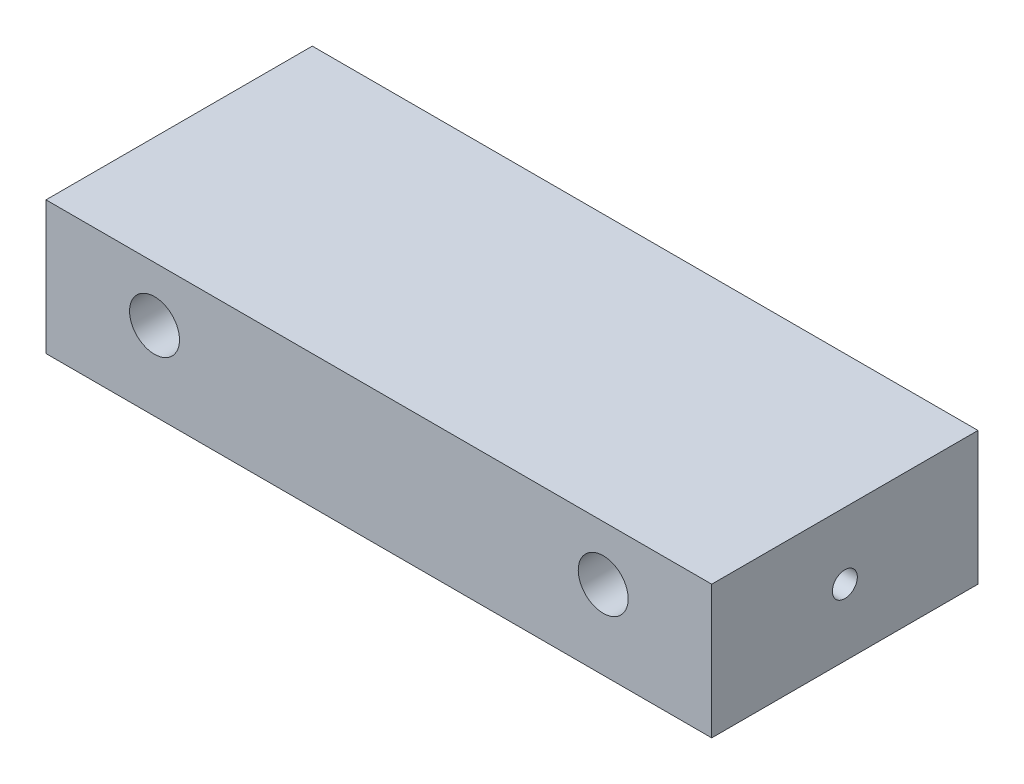
from build123d import *

# Parameters (mm, degrees)
SKETCH1_W           = 254
SKETCH1_H           = 50.8
BOSS_EXTRUDE1_DEPTH = 101.6
SKETCH2_R           = 9.525
CUT_EXTRUDE1_DEPTH  = 25.4
SKETCH3_R           = 4.7625
CUT_EXTRUDE2_DEPTH  = 25.4
SKETCH4_R           = 4.7625
CUT_EXTRUDE3_DEPTH  = 25.4
CUT_EXTRUDE4_START  = -25.4
SKETCH5_R           = 4.7625
CUT_EXTRUDE4_DEPTH  = 25.4


with BuildPart() as part:
    # Sketch1 → Boss-Extrude1 (new body)
    with BuildSketch(Plane.XY):
        Rectangle(SKETCH1_W, SKETCH1_H)
    extrude(amount=BOSS_EXTRUDE1_DEPTH)

    # Sketch2 → Cut-Extrude1 (cut)
    with BuildSketch(Plane.XY.offset(101.6)):
        with Locations((-85.598, 4.5974)):
            Circle(SKETCH2_R)
        with Locations(Location((85.598, 4.5974, 0), (0, 0, 180))):
            Circle(SKETCH2_R)
    extrude(amount=-CUT_EXTRUDE1_DEPTH, mode=Mode.SUBTRACT)

    # Sketch3 → Cut-Extrude2 (cut)
    with BuildSketch(Plane(origin=(0, 0, 0), x_dir=(-1, 0, 0), z_dir=(0, 0, -1))):
        with Locations((-57.15, 0)):
            Circle(SKETCH3_R)
        with Locations(Location((57.15, 0, 0), (0, 0, 180))):
            Circle(SKETCH3_R)
    extrude(amount=-CUT_EXTRUDE2_DEPTH, mode=Mode.SUBTRACT)

    # Sketch4 → Cut-Extrude3 (cut)
    with BuildSketch(Plane(origin=(127, 0, 0), x_dir=(0, 0, -1), z_dir=(1, 0, 0))):
        with Locations((-50.8, 0)):
            Circle(SKETCH4_R)
    extrude(amount=-CUT_EXTRUDE3_DEPTH, mode=Mode.SUBTRACT)

    # Sketch5 → Cut-Extrude4 (cut)
    with BuildSketch(Plane.ZY.offset(127).offset(CUT_EXTRUDE4_START)):
        with Locations(Location((50.8, 0, 0), (0, 0, 180))):
            Circle(SKETCH5_R)
    extrude(amount=CUT_EXTRUDE4_DEPTH, mode=Mode.SUBTRACT)


solid = part.part
